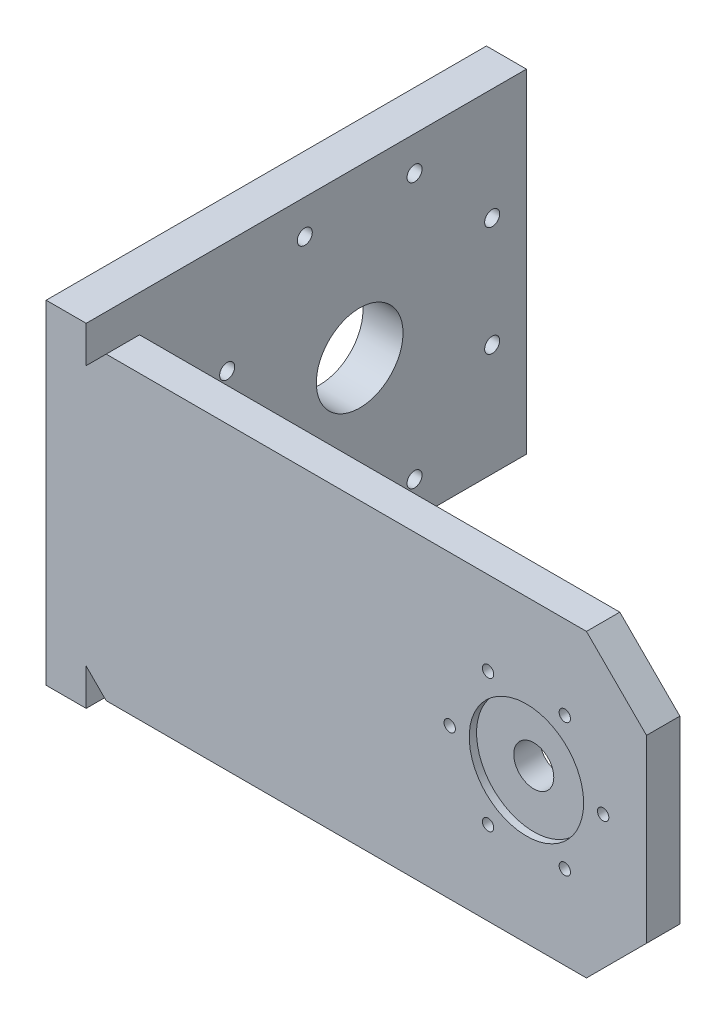
from build123d import *

# Parameters (mm, degrees)
SK_TOP_PLATE_R         = 1.7
SK_TOP_PLATE_R_2       = 6
TOP_PLATE_DEPTH        = 10
SK_YAW_PILOT_RECESS_R  = 17.15
YAW_PILOT_RECESS_DEPTH = 2.2
SK_BACK_PLATE_W        = 132
SK_BACK_PLATE_H        = 100
SK_BACK_PLATE_R        = 2.25
SK_BACK_PLATE_R_2      = 13
BACK_PLATE_DEPTH       = 12
RIB_DEPTH              = 8
SK_KEEL_W              = 58
SK_KEEL_H              = 15
KEEL_DEPTH             = 12


with BuildPart() as part:
    # SK_Top_Plate → Top_Plate (new body)
    with BuildSketch(Plane.XY.offset(72)):
        Polygon((-126, -45), (18, -45), (36, -27), (36, 27), (18, 45), (-126, 45), (-144, 27), (-144, -27), align=None)
        with Locations((23, 0)):
            Circle(SK_TOP_PLATE_R, mode=Mode.SUBTRACT)
        with Locations((11.5, 19.918584287)):
            Circle(SK_TOP_PLATE_R, mode=Mode.SUBTRACT)
        with Locations((-11.5, 19.918584287)):
            Circle(SK_TOP_PLATE_R, mode=Mode.SUBTRACT)
        with Locations((-23, 0)):
            Circle(SK_TOP_PLATE_R, mode=Mode.SUBTRACT)
        with Locations((-11.5, -19.918584287)):
            Circle(SK_TOP_PLATE_R, mode=Mode.SUBTRACT)
        with Locations((11.5, -19.918584287)):
            Circle(SK_TOP_PLATE_R, mode=Mode.SUBTRACT)
        Circle(SK_TOP_PLATE_R_2, mode=Mode.SUBTRACT)
    extrude(amount=TOP_PLATE_DEPTH)

    # SK_Yaw_Pilot_Recess → Yaw_Pilot_Recess (cut)
    with BuildSketch(Plane.XY.offset(82)):
        Circle(SK_YAW_PILOT_RECESS_R)
    extrude(amount=-YAW_PILOT_RECESS_DEPTH, mode=Mode.SUBTRACT)

    # SK_Back_Plate → Back_Plate (add)
    with BuildSketch(Plane(origin=(-144, 0, 0), x_dir=(0, 0, -1), z_dir=(1, 0, 0))):
        with Locations((-16, 0)):
            Rectangle(SK_BACK_PLATE_W, SK_BACK_PLATE_H)
        with Locations((39.726819898, 16.455387592)):
            Circle(SK_BACK_PLATE_R, mode=Mode.SUBTRACT)
        with Locations((16.455387592, 39.726819898)):
            Circle(SK_BACK_PLATE_R, mode=Mode.SUBTRACT)
        with Locations((-16.455387592, 39.726819898)):
            Circle(SK_BACK_PLATE_R, mode=Mode.SUBTRACT)
        with Locations((-39.726819898, 16.455387592)):
            Circle(SK_BACK_PLATE_R, mode=Mode.SUBTRACT)
        with Locations((-39.726819898, -16.455387592)):
            Circle(SK_BACK_PLATE_R, mode=Mode.SUBTRACT)
        with Locations((-16.455387592, -39.726819898)):
            Circle(SK_BACK_PLATE_R, mode=Mode.SUBTRACT)
        with Locations((16.455387592, -39.726819898)):
            Circle(SK_BACK_PLATE_R, mode=Mode.SUBTRACT)
        with Locations((39.726819898, -16.455387592)):
            Circle(SK_BACK_PLATE_R, mode=Mode.SUBTRACT)
        Circle(SK_BACK_PLATE_R_2, mode=Mode.SUBTRACT)
    extrude(amount=BACK_PLATE_DEPTH)

    # SK_Rib → Rib (add)
    with BuildSketch(Plane(origin=(0, -4, 0), x_dir=(1, 0, 0), z_dir=(0, 1, 0))):
        Polygon((-144, -52), (-30, -72), (-144, -72), align=None)
    extrude(amount=RIB_DEPTH)

    # SK_Keel → Keel (add)
    with BuildSketch(Plane(origin=(0, -6, 0), x_dir=(1, 0, 0), z_dir=(0, 1, 0))):
        with Locations((-115, -64.5)):
            Rectangle(SK_KEEL_W, SK_KEEL_H)
    extrude(amount=KEEL_DEPTH)


solid = part.part
